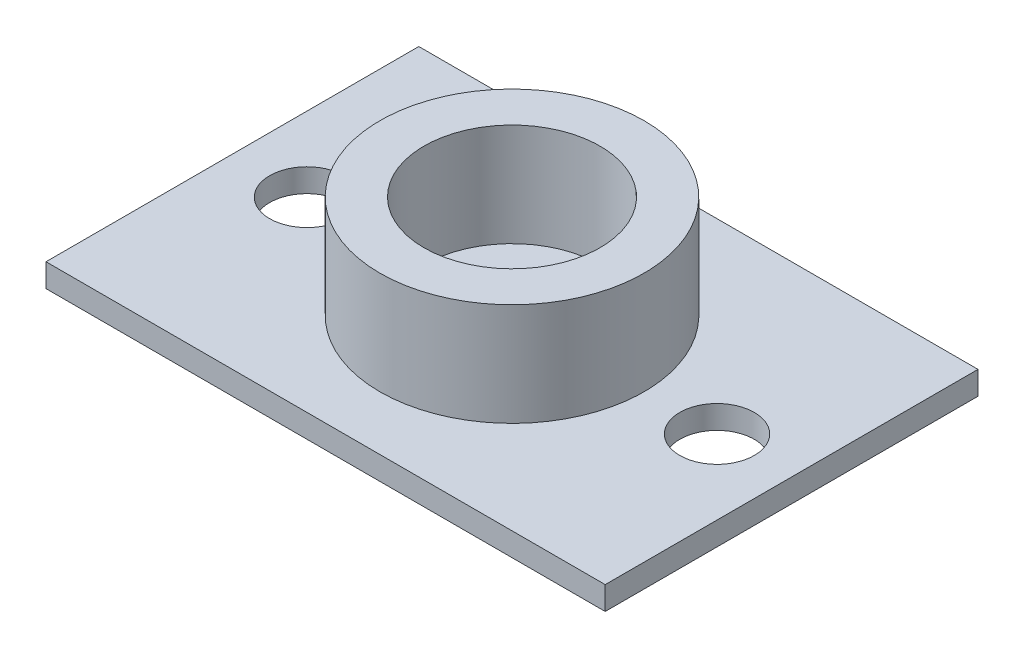
from build123d import *

# Parameters (mm, degrees)
SKETCH1_W           = 38.1
SKETCH1_H           = 25.4
BOSS_EXTRUDE1_DEPTH = 1.5875
SKETCH3_R           = 9
SKETCH3_R_2         = 6
BOSS_EXTRUDE2_DEPTH = 7
SKETCH4_R           = 2.54
CUT_EXTRUDE1_DEPTH  = 30.632507172


with BuildPart() as part:
    # Sketch1 → Boss-Extrude1 (new body)
    with BuildSketch(Plane(origin=(0, 0, 0), x_dir=(1, 0, 0), z_dir=(0, 1, 0))):
        with Locations((-6.79173913, 0)):
            Rectangle(SKETCH1_W, SKETCH1_H)
    extrude(amount=BOSS_EXTRUDE1_DEPTH)

    # Sketch3 → Boss-Extrude2 (add)
    with BuildSketch(Plane(origin=(0, 1.5875, 0), x_dir=(1, 0, 0), z_dir=(0, 1, 0))):
        with Locations((-6.79173913, 0)):
            Circle(SKETCH3_R)
        with Locations((-6.79173913, 0)):
            Circle(SKETCH3_R_2, mode=Mode.SUBTRACT)
    extrude(amount=BOSS_EXTRUDE2_DEPTH)

    # Sketch4 → Cut-Extrude1 (cut, through all)
    with BuildSketch(Plane(origin=(0, 1.5875, 0), x_dir=(1, 0, 0), z_dir=(0, 1, 0))):
        with Locations((7.17826087, 0)):
            Circle(SKETCH4_R)
        with Locations((-20.76173913, 0)):
            Circle(SKETCH4_R)
    extrude(amount=-CUT_EXTRUDE1_DEPTH, mode=Mode.SUBTRACT)


solid = part.part
